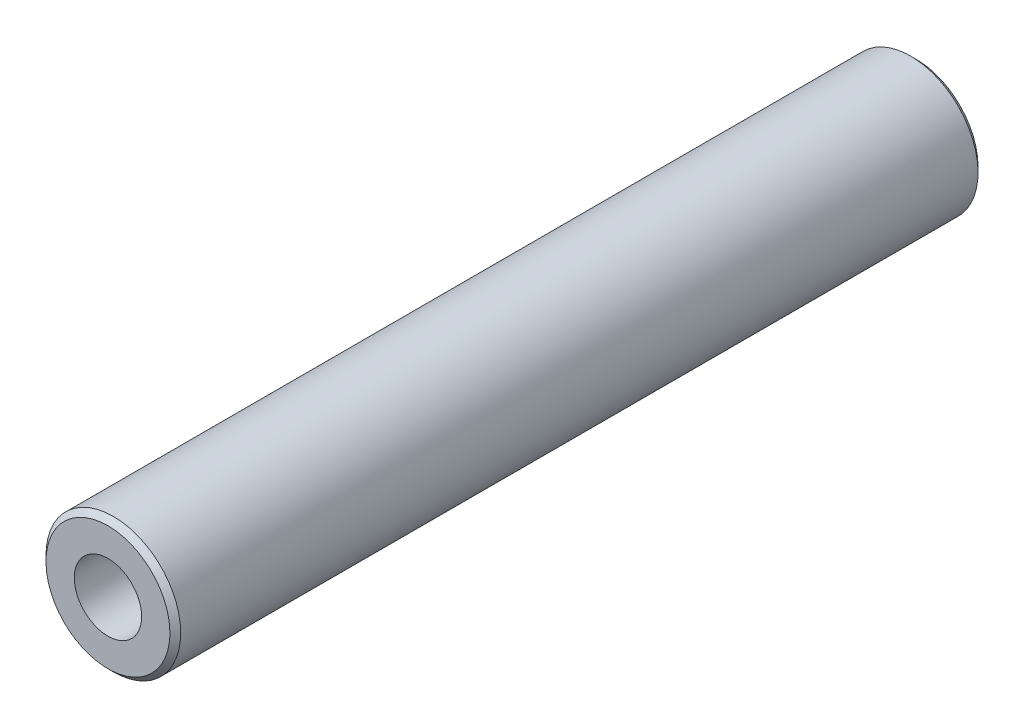
from build123d import *

# Parameters (mm, degrees)
SKETCH_1_W     = 30
SKETCH_1_H     = 2.5
CHAMFER_1_SIZE = 0.2


with BuildPart() as part:
    # 草图1 → 旋转1 (revolve)
    with BuildSketch(Plane(origin=(0, 0, 0), x_dir=(0, 0, -1), z_dir=(1, 0, 0)), mode=Mode.PRIVATE) as revolve_1_sk:
        with Locations((0, 1.25)):
            Rectangle(SKETCH_1_W, SKETCH_1_H)
    revolve(revolve_1_sk.sketch.rotate(Axis((0, 0, 15), (0, 0, -1)), 180), axis=Axis((0, 0, 15), (0, 0, -1)))

    # 草图3 → Hole Wizard 1 (revolve, cut)
    with BuildSketch(Plane(origin=(0, 0, 15), x_dir=(0, -1, 0), z_dir=(1, 0, 0))):
        Polygon((0, 0), (0, 14.251075774), (1.25, 13.5), (1.25, 0), align=None)
    hole_wizard_1 = revolve(axis=Axis((0, 0, 21.35), (0, 0, -1)), mode=Mode.SUBTRACT)

    # 镜向1: Hole Wizard 1 across plane
    add(hole_wizard_1.mirror(Plane.XY), mode=Mode.SUBTRACT)

    # 倒角1
    chamfer_1_edges = [part.edges().sort_by_distance(p)[0] for p in [
        (0, 2.5, -15),
        (0, 2.5, 15),
    ]]
    chamfer(chamfer_1_edges, length=CHAMFER_1_SIZE)


solid = part.part
